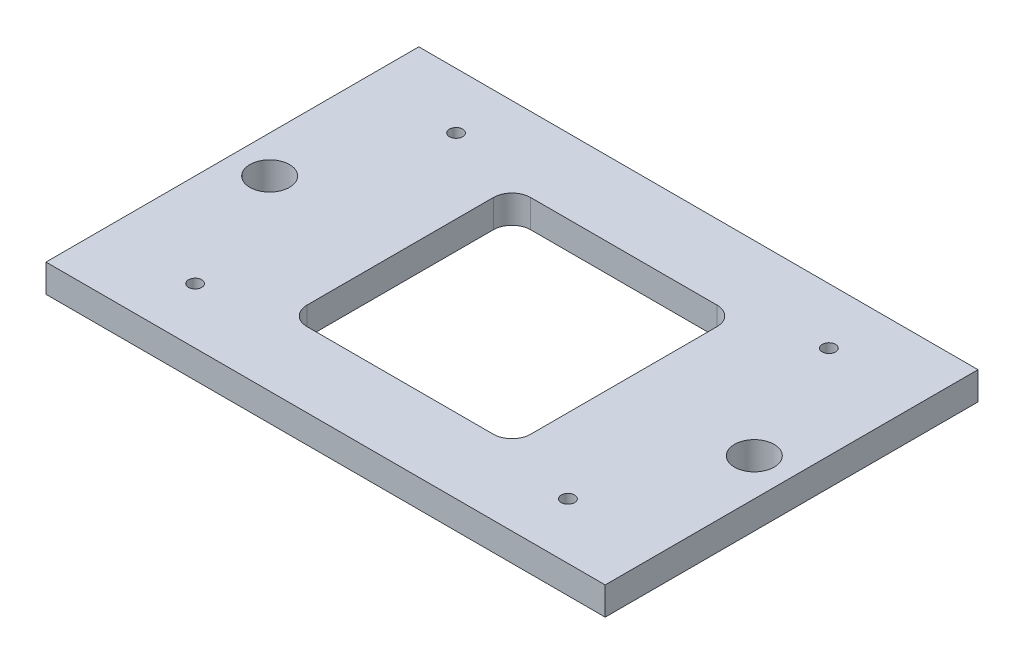
from build123d import *

# Parameters (mm, degrees)
SKETCH1_W                        = 95.25
SKETCH1_H                        = 63.5
BOSS_EXTRUDE1_DEPTH              = 2.38125
CUT_EXTRUDE1_REACH               = 59.436
SKETCH2_W                        = 38.1
SKETCH2_H                        = 38.1
F_4_40_TAPPED_HOLE1_D            = 2.2606
F_17_64_0_26563_DIAMETER_HOLE1_D = 6.747002
FILLET1_R                        = 3.175
FILLET2_R                        = 3.175
FILLET3_R                        = 3.175
FILLET4_R                        = 3.175


with BuildPart() as part:
    # Sketch1 → Boss-Extrude1 (new, symmetric)
    with BuildSketch(Plane(origin=(0, 0, 0), x_dir=(1, 0, 0), z_dir=(0, 1, 0))):
        Rectangle(SKETCH1_W, SKETCH1_H)
    extrude(amount=BOSS_EXTRUDE1_DEPTH, both=True)

    # Sketch2 → Cut-Extrude1 (cut, up to next)
    with BuildSketch(Plane(origin=(0, 2.38125, 0), x_dir=(1, 0, 0), z_dir=(0, 1, 0)), mode=Mode.PRIVATE) as cut_extrude1_sk1:
        Rectangle(SKETCH2_W, SKETCH2_H)
    cut_extrude1_tool1 = extrude(cut_extrude1_sk1.sketch, amount=-CUT_EXTRUDE1_REACH, mode=Mode.PRIVATE) & part.part
    add(cut_extrude1_tool1.solids().sort_by_distance((0, 2.38125, 0))[0], mode=Mode.SUBTRACT)

    # #4-40 Tapped Hole1 (through all)
    with Locations(Plane(origin=(0, 2.38125, 0), x_dir=(1, 0, 0), z_dir=(0, 1, 0))):
        with Locations((-31.75, 22.225), (31.75, 22.225)):
            f_4_40_tapped_hole1 = Hole(F_4_40_TAPPED_HOLE1_D / 2)

    # Mirror1: #4-40 Tapped Hole1 across plane
    add(f_4_40_tapped_hole1.mirror(Plane.XY), mode=Mode.SUBTRACT)

    # 17/64 (0.26563) Diameter Hole1 (through all)
    with Locations(Plane(origin=(0, 2.38125, 0), x_dir=(1, 0, 0), z_dir=(0, 1, 0))):
        with Locations((-41.275, 0), (41.275, 0)):
            Hole(F_17_64_0_26563_DIAMETER_HOLE1_D / 2)

    # Fillet1
    fillet1_edges = [part.edges().sort_by_distance(p)[0] for p in [
        (-19.05, 0, -19.05),
    ]]
    fillet(fillet1_edges, radius=FILLET1_R)

    # Fillet2
    fillet2_edges = [part.edges().sort_by_distance(p)[0] for p in [
        (-19.05, 0, 19.05),
    ]]
    fillet(fillet2_edges, radius=FILLET2_R)

    # Fillet3
    fillet3_edges = [part.edges().sort_by_distance(p)[0] for p in [
        (19.05, 0, -19.05),
    ]]
    fillet(fillet3_edges, radius=FILLET3_R)

    # Fillet4
    fillet4_edges = [part.edges().sort_by_distance(p)[0] for p in [
        (19.05, 0, 19.05),
    ]]
    fillet(fillet4_edges, radius=FILLET4_R)


solid = part.part
